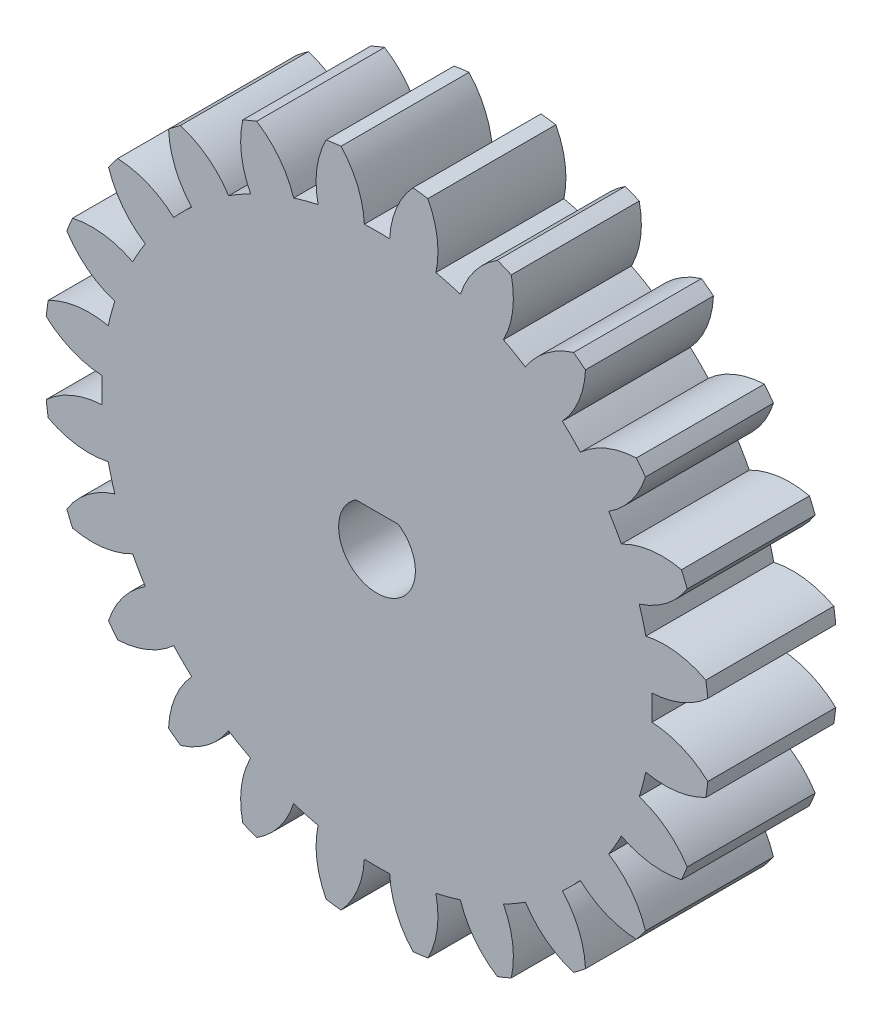
from build123d import *

# Parameters (mm, degrees)
SKETCH6_R           = 26
BOSS_EXTRUDE1_DEPTH = 10
CUT_EXTRUDE3_DEPTH  = 39.105117767
CIRPATTERN2_COUNT   = 24
CUT_EXTRUDE4_DEPTH  = 38.897178127
SKETCH9_R           = 5
BOSS_EXTRUDE2_DEPTH = 4


with BuildPart() as part:
    # Sketch6 → Boss-Extrude1 (new body)
    with BuildSketch(Plane.XY):
        Circle(SKETCH6_R)
    extrude(amount=BOSS_EXTRUDE1_DEPTH)

    # Sketch7 → Cut-Extrude3 (cut, through all)
    with BuildSketch(Plane.XY.offset(10)):
        with BuildLine():
            ThreePointArc((-0.990237597, 21.477183929), (-1.515765167, 23.822734617), (-2.811039843, 25.847592828))
            ThreePointArc((-2.811039843, 25.847592828), (0, 26), (2.811039843, 25.847592828))
            ThreePointArc((2.811039843, 25.847592828), (1.515765167, 23.822734617), (0.990237597, 21.477183929))
            ThreePointArc((0.990237597, 21.477183929), (0, 21.5), (-0.990237597, 21.477183929))
        make_face()
    cut_extrude3 = extrude(amount=-CUT_EXTRUDE3_DEPTH, mode=Mode.SUBTRACT)

    # CirPattern2: Cut-Extrude3 ×24 about axis
    cirpattern2_axis = Axis((0, 0, 0), (0, 0, 1))
    for i in range(1, CIRPATTERN2_COUNT):
        add(cut_extrude3.rotate(cirpattern2_axis, i * 360 / CIRPATTERN2_COUNT), mode=Mode.SUBTRACT)

    # Sketch8 → Cut-Extrude4 (cut, through all)
    with BuildSketch(Plane.XY.offset(10)):
        with BuildLine():
            Line((-1.658312395, 2.5), (1.658312395, 2.5))
            ThreePointArc((1.658312395, 2.5), (0, -3), (-1.658312395, 2.5))
        make_face()
    extrude(amount=-CUT_EXTRUDE4_DEPTH, mode=Mode.SUBTRACT)

    # Sketch9 → Boss-Extrude2 (add)
    with BuildSketch(Plane(origin=(0, 0, 0), x_dir=(-1, 0, 0), z_dir=(0, 0, -1))):
        with Locations(Location((0, 0, 0), (0, 0, 180))):
            Circle(SKETCH9_R)
        with BuildLine():
            Line((-1.658312395, 2.5), (1.658312395, 2.5))
            ThreePointArc((1.658312395, 2.5), (0, -3), (-1.658312395, 2.5))
        make_face(mode=Mode.SUBTRACT)
    extrude(amount=BOSS_EXTRUDE2_DEPTH)


solid = part.part
